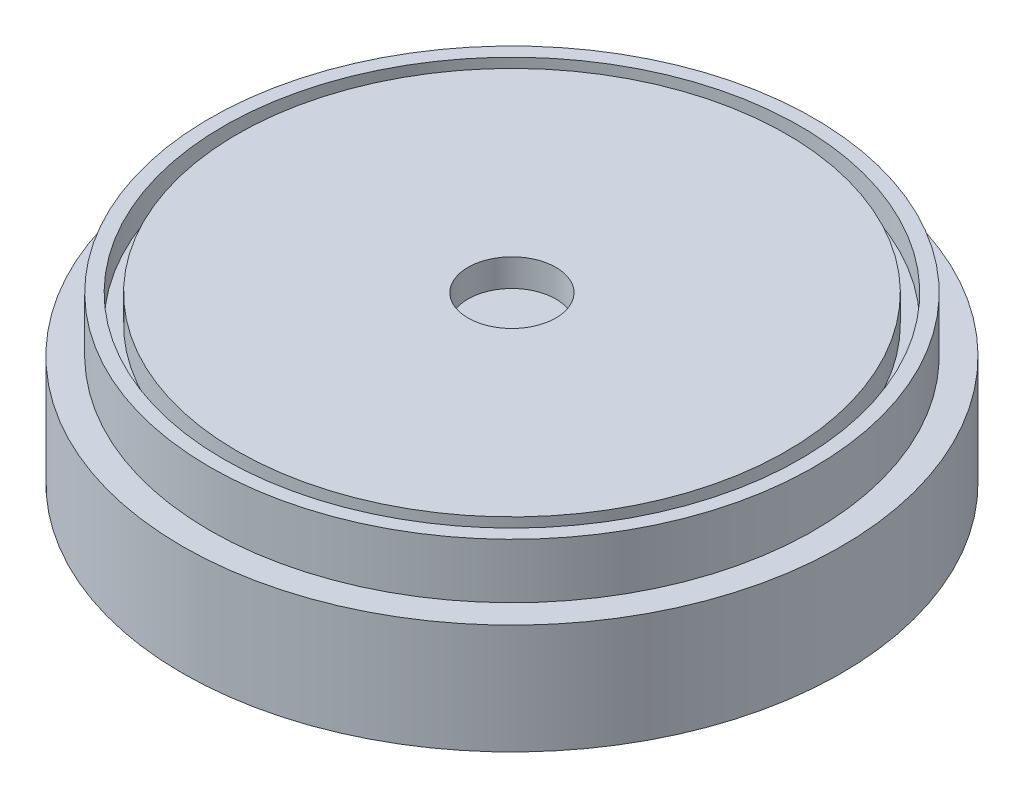
from build123d import *

# Parameters (mm, degrees)
SKETCH1_R           = 120
BOSS_EXTRUDE1_DEPTH = 40
BOSS_EXTRUDE2_START = 40
SKETCH1_3_R         = 110
BOSS_EXTRUDE2_DEPTH = 20
CUT_EXTRUDE1_START  = 60
SKETCH1_5_R         = 105
SKETCH1_5_R_2       = 100
CUT_EXTRUDE1_DEPTH  = 10
SKETCH2_R           = 16
CUT_EXTRUDE2_DEPTH  = 10


with BuildPart() as part:
    # Sketch1 → Boss-Extrude1 (new body)
    with BuildSketch(Plane(origin=(0, 0, 0), x_dir=(1, 0, 0), z_dir=(0, 1, 0))):
        with Locations(Location((0, 0, 0), (0, 0, 270))):
            Circle(SKETCH1_R)
    extrude(amount=BOSS_EXTRUDE1_DEPTH)

    # Sketch1<3> → Boss-Extrude2 (add)
    with BuildSketch(Plane(origin=(0, 0, 0), x_dir=(1, 0, 0), z_dir=(0, 1, 0)).offset(BOSS_EXTRUDE2_START)):
        with Locations(Location((0, 0, 0), (0, 0, 270))):
            Circle(SKETCH1_3_R)
    extrude(amount=BOSS_EXTRUDE2_DEPTH)

    # Sketch1<5> → Cut-Extrude1 (cut)
    with BuildSketch(Plane(origin=(0, 0, 0), x_dir=(1, 0, 0), z_dir=(0, 1, 0)).offset(CUT_EXTRUDE1_START)):
        with Locations(Location((0, 0, 0), (0, 0, 270))):
            Circle(SKETCH1_5_R)
        with Locations(Location((0, 0, 0), (0, 0, 270))):
            Circle(SKETCH1_5_R_2, mode=Mode.SUBTRACT)
    extrude(amount=-CUT_EXTRUDE1_DEPTH, mode=Mode.SUBTRACT)

    # Sketch2 → Cut-Extrude2 (cut)
    with BuildSketch(Plane(origin=(0, 60, 0), x_dir=(1, 0, 0), z_dir=(0, 1, 0))):
        with Locations(Location((0, 0, 0), (0, 0, 270))):
            Circle(SKETCH2_R)
    extrude(amount=-CUT_EXTRUDE2_DEPTH, mode=Mode.SUBTRACT)


solid = part.part
